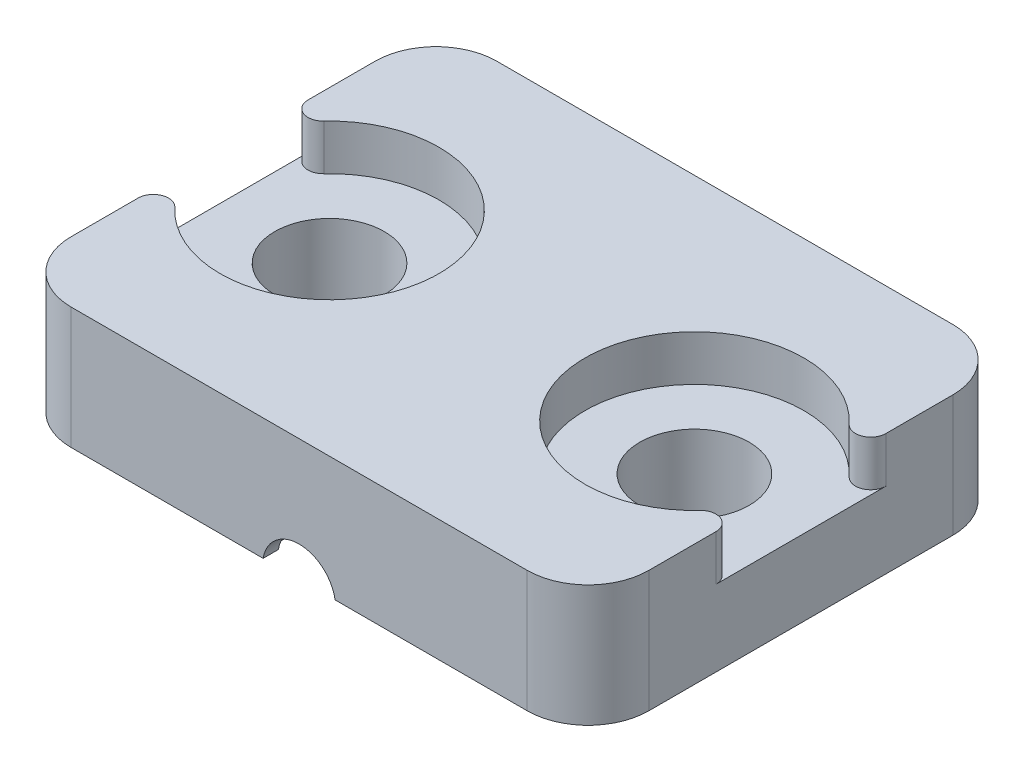
from build123d import *

# Parameters (mm, degrees)
SKETCH1_W           = 24.13
SKETCH1_H           = 17.78
SKETCH1_R           = 2.286
BOSS_EXTRUDE1_DEPTH = 5.08
SKETCH2_R           = 1.778
CUT_EXTRUDE1_DEPTH  = 23.079380086
BOSS_EXTRUDE2_DEPTH = 0.635
LPATTERN1_COUNT     = 10
LPATTERN1_PITCH     = 1.905
SKETCH5_R           = 4.572
CUT_EXTRUDE2_DEPTH  = 1.905
FILLET1_R           = 0.635
FILLET2_R           = 2.54
SKETCH6_R           = 3.81
CUT_EXTRUDE3_DEPTH  = 2.54


with BuildPart() as part:
    # Sketch1 → Boss-Extrude1 (new body)
    with BuildSketch(Plane(origin=(0, 0, 0), x_dir=(1, 0, 0), z_dir=(0, 1, 0))):
        Rectangle(SKETCH1_W, SKETCH1_H)
        with Locations(Location((-7.62, 0, 0), (0, 0, 270))):
            Circle(SKETCH1_R, mode=Mode.SUBTRACT)
        with Locations(Location((7.62, 0, 0), (0, 0, 90))):
            Circle(SKETCH1_R, mode=Mode.SUBTRACT)
    extrude(amount=BOSS_EXTRUDE1_DEPTH)

    # Sketch2 → Cut-Extrude1 (cut, through all)
    with BuildSketch(Plane.XY.offset(8.89)):
        with Locations((0, -0.254)):
            Circle(SKETCH2_R)
    extrude(amount=-CUT_EXTRUDE1_DEPTH, mode=Mode.SUBTRACT)

    # Sketch4 → Boss-Extrude2 (add)
    with BuildSketch(Plane.XY.offset(8.89)):
        with BuildLine():
            ThreePointArc((1.75976362, 0), (0, 1.524), (-1.75976362, 0))
            Line((-1.75976362, 0), (-1.502684265, 0))
            ThreePointArc((-1.502684265, 0), (0, 1.27), (1.502684265, 0))
            Line((1.502684265, 0), (1.75976362, 0))
        make_face()
    boss_extrude2 = extrude(amount=-BOSS_EXTRUDE2_DEPTH)

    # LPattern1: Boss-Extrude2 ×10
    with Locations(*[(0, 0, -i * LPATTERN1_PITCH) for i in range(1, LPATTERN1_COUNT)]):
        add(boss_extrude2)

    # Sketch5 → Cut-Extrude2 (cut)
    with BuildSketch(Plane(origin=(0, 5.08, 0), x_dir=(1, 0, 0), z_dir=(0, 1, 0))):
        with Locations((-7.62, 0)):
            Circle(SKETCH5_R)
        with Locations((7.62, 0)):
            Circle(SKETCH5_R)
    extrude(amount=-CUT_EXTRUDE2_DEPTH, mode=Mode.SUBTRACT)

    # Fillet1
    fillet1_edges = [part.edges().sort_by_distance(p)[0] for p in [
        (12.065, 4.1275, -1.070121021),
        (12.065, 4.1275, 1.070121021),
        (-12.065, 4.1275, 1.070121021),
        (-12.065, 4.1275, -1.070121021),
    ]]
    fillet(fillet1_edges, radius=FILLET1_R)

    # Fillet2
    fillet2_edges = [part.edges().sort_by_distance(p)[0] for p in [
        (-12.065, 2.54, -8.89),
        (12.065, 2.54, -8.89),
        (12.065, 2.54, 8.89),
        (-12.065, 2.54, 8.89),
    ]]
    fillet(fillet2_edges, radius=FILLET2_R)

    # Sketch6 → Cut-Extrude3 (cut, symmetric)
    with BuildSketch(Plane.XY):
        Circle(SKETCH6_R)
    extrude(amount=CUT_EXTRUDE3_DEPTH, both=True, mode=Mode.SUBTRACT)


solid = part.part
